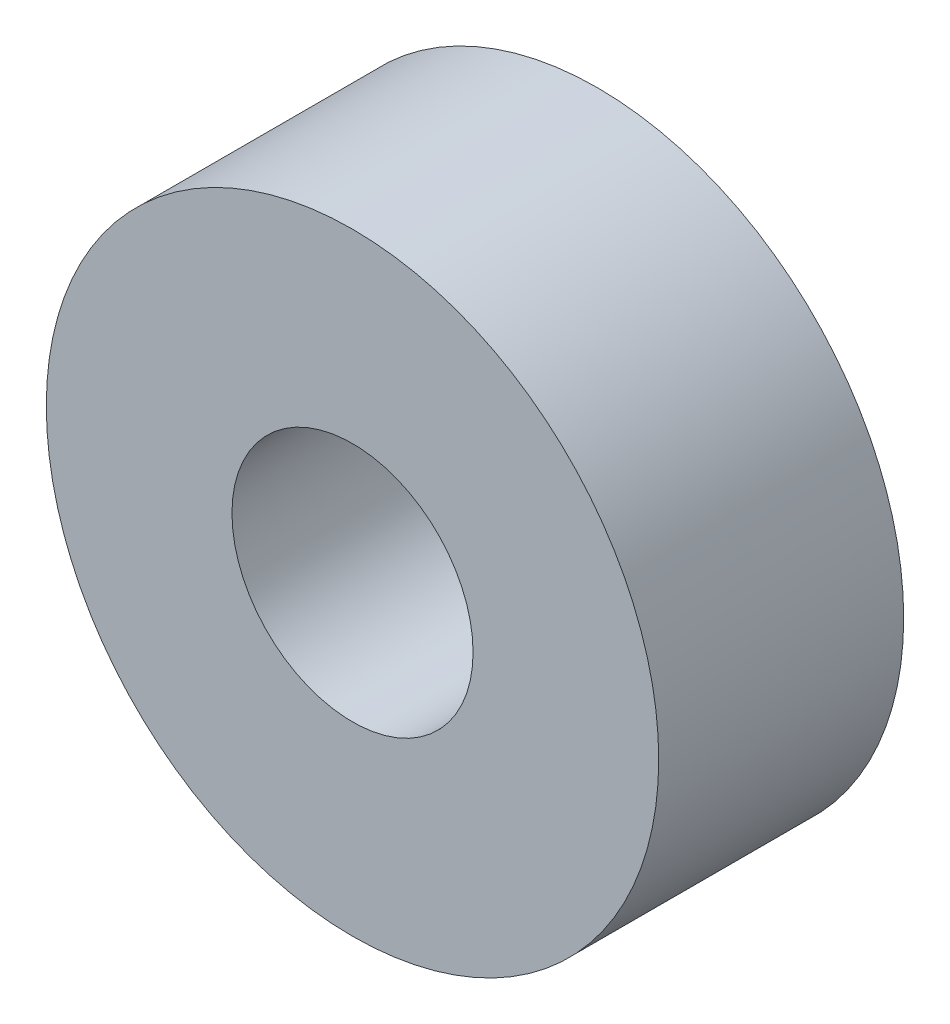
from build123d import *

# Parameters (mm, degrees)
SKETCH1_R           = 12.7
SKETCH1_R_2         = 5
BOSS_EXTRUDE1_DEPTH = 5.08


with BuildPart() as part:
    # Sketch1 → Boss-Extrude1 (new, symmetric)
    with BuildSketch(Plane.XY):
        Circle(SKETCH1_R)
        Circle(SKETCH1_R_2, mode=Mode.SUBTRACT)
    extrude(amount=BOSS_EXTRUDE1_DEPTH, both=True)


solid = part.part
